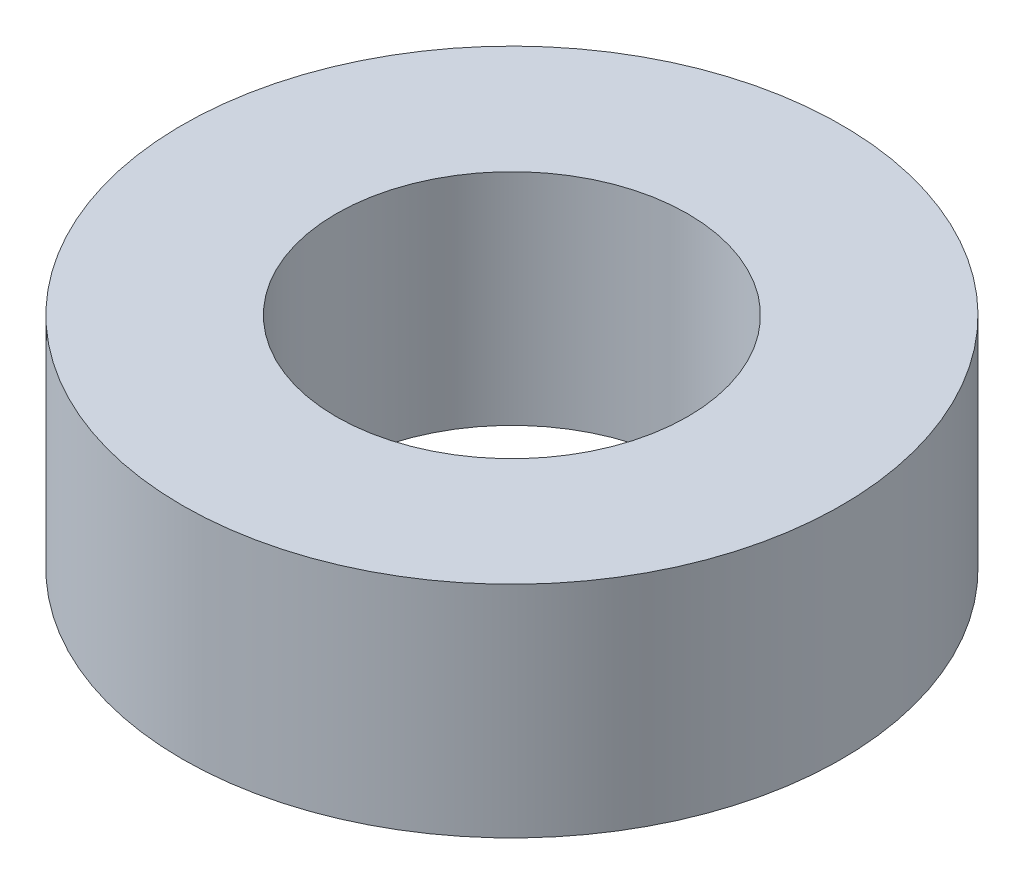
from build123d import *

# Parameters (mm, degrees)
SKETCH3_R           = 7.62
BOSS_EXTRUDE1_DEPTH = 5.08
SKETCH4_R           = 4.064
CUT_EXTRUDE1_DEPTH  = 5.08


with BuildPart() as part:
    # Sketch3 → Boss-Extrude1 (new body)
    with BuildSketch(Plane(origin=(0, 0, 0), x_dir=(1, 0, 0), z_dir=(0, 1, 0))):
        with Locations(Location((0, 0, 0), (0, 0, 270))):
            Circle(SKETCH3_R)
    extrude(amount=BOSS_EXTRUDE1_DEPTH)

    # Sketch4 → Cut-Extrude1 (cut)
    with BuildSketch(Plane(origin=(0, 5.08, 0), x_dir=(1, 0, 0), z_dir=(0, 1, 0))):
        with Locations(Location((0, 0, 0), (0, 0, 270))):
            Circle(SKETCH4_R)
    extrude(amount=-CUT_EXTRUDE1_DEPTH, mode=Mode.SUBTRACT)


solid = part.part
